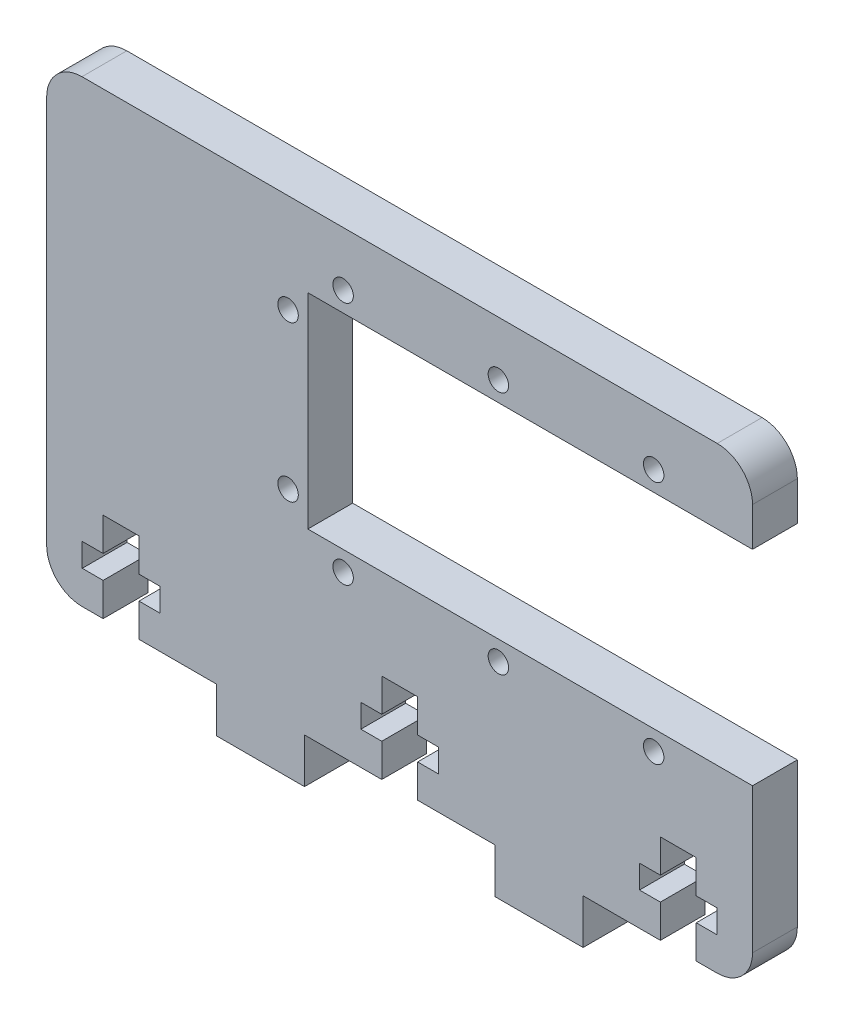
from build123d import *

# Parameters (mm, degrees)
SKETCH1_W              = 100
SKETCH1_H              = 65
BOSS_EXTRUDE1_DEPTH    = 6.35
M2_5_CLEARANCE_HOLE1_D = 2.9
SKETCH4_W              = 63
SKETCH4_H              = 29
CUT_EXTRUDE1_DEPTH     = 120.43752551
FILLET2_R              = 5
SKETCH5_W              = 12.5
SKETCH5_H              = 6.35
BOSS_EXTRUDE2_DEPTH    = 6.35
CUT_EXTRUDE2_DEPTH     = 120.43752551


with BuildPart() as part:
    # Sketch1 → Boss-Extrude1 (new body)
    with BuildSketch(Plane.XY):
        with Locations((50, 32.5)):
            Rectangle(SKETCH1_W, SKETCH1_H)
    extrude(amount=BOSS_EXTRUDE1_DEPTH)

    # M2.5 Clearance Hole1 (through all)
    with Locations(Plane.XY.offset(6.35)):
        with Locations((86, 57.3), (64, 57.3), (42, 57.3), (34.2, 51), (86, 22.7), (64, 22.7), (42, 22.7), (34.2, 29)):
            Hole(M2_5_CLEARANCE_HOLE1_D / 2)

    # Sketch4 → Cut-Extrude1 (cut, through all)
    with BuildSketch(Plane.XY.offset(6.35)):
        with Locations((68.5, 40)):
            Rectangle(SKETCH4_W, SKETCH4_H)
    extrude(amount=-CUT_EXTRUDE1_DEPTH, mode=Mode.SUBTRACT)

    # Fillet2
    fillet2_edges = [part.edges().sort_by_distance(p)[0] for p in [
        (0, 65, 3.175),
        (100, 65, 3.175),
        (100, 0, 3.175),
        (0, 0, 3.175),
    ]]
    fillet(fillet2_edges, radius=FILLET2_R)

    # Sketch5 → Boss-Extrude2 (add)
    with BuildSketch(Plane.XY.offset(6.35)):
        with Locations((69.75, -3.175)):
            Rectangle(SKETCH5_W, SKETCH5_H)
        with Locations((30.2758, -3.175)):
            Rectangle(SKETCH5_W, SKETCH5_H)
    extrude(amount=-BOSS_EXTRUDE2_DEPTH)

    # Sketch7 → Cut-Extrude2 (cut, through all)
    with BuildSketch(Plane(origin=(0, 0, 0), x_dir=(-1, 0, 0), z_dir=(0, 0, -1))):
        Polygon((-92.0271, 4.699), (-92.0271, 0), (-86.9471, 0), (-86.9471, 4.699), (-83.988, 4.699), (-83.988, 8.001), (-86.9471, 8.001), (-86.9471, 12.7), (-92.0271, 12.7), (-92.0271, 8.001), (-94.9862, 8.001), (-94.9862, 4.699), align=None)
        Polygon((-52.5529, 4.699), (-52.5529, 0), (-47.4729, 0), (-47.4729, 4.699), (-44.5138, 4.699), (-44.5138, 8.001), (-47.4729, 8.001), (-47.4729, 12.7), (-52.5529, 12.7), (-52.5529, 8.001), (-55.512, 8.001), (-55.512, 4.699), align=None)
        Polygon((-13.0787, 4.699), (-13.0787, 0), (-7.9987, 0), (-7.9987, 4.699), (-5.0396, 4.699), (-5.0396, 8.001), (-7.9987, 8.001), (-7.9987, 12.7), (-13.0787, 12.7), (-13.0787, 8.001), (-16.0378, 8.001), (-16.0378, 4.699), align=None)
    extrude(amount=-CUT_EXTRUDE2_DEPTH, mode=Mode.SUBTRACT)


solid = part.part
